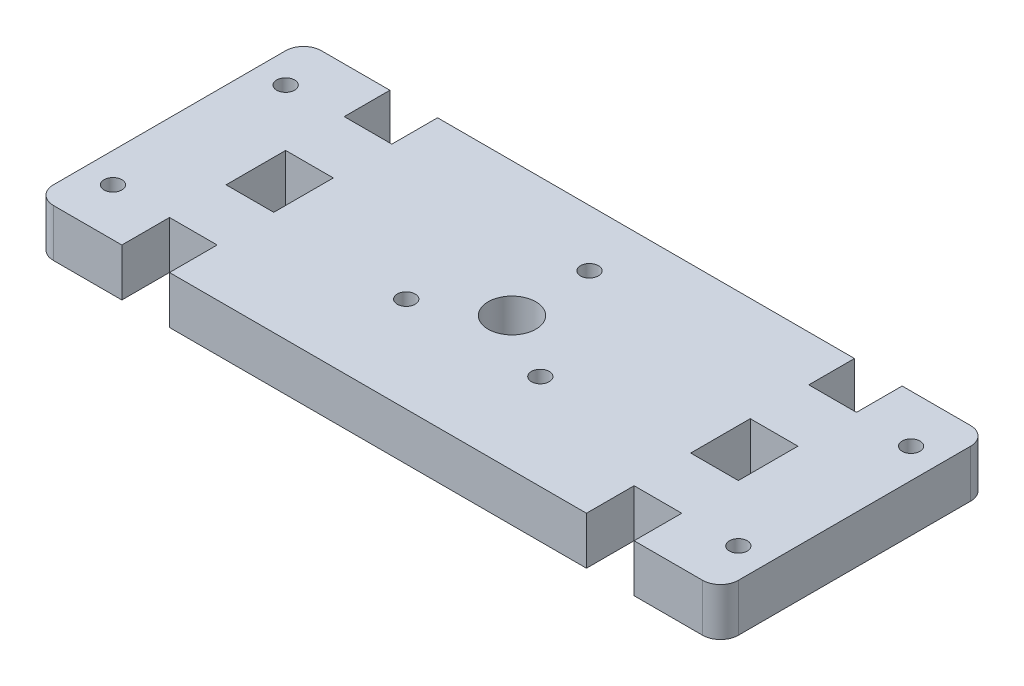
from build123d import *

# Parameters (mm, degrees)
SKETCH1_W           = 115
SKETCH1_H           = 45
SKETCH1_R           = 4
SKETCH1_R_2         = 1.5
BOSS_EXTRUDE1_DEPTH = 8
SKETCH2_W           = 8
SKETCH2_H           = 10
SKETCH2_H_2         = 8
CUT_EXTRUDE1_DEPTH  = 16
FILLET1_R           = 3
SKETCH4_R           = 1.5
CUT_EXTRUDE2_DEPTH  = 16


with BuildPart() as part:
    # Sketch1 → Boss-Extrude1 (new body)
    with BuildSketch(Plane(origin=(0, 0, 0), x_dir=(1, 0, 0), z_dir=(0, 1, 0))):
        Rectangle(SKETCH1_W, SKETCH1_H)
        with Locations(Location((0, 0, 0), (0, 0, 270))):
            Circle(SKETCH1_R, mode=Mode.SUBTRACT)
        with Locations(Location((0, 13, 0), (0, 0, 270))):
            Circle(SKETCH1_R_2, mode=Mode.SUBTRACT)
        with Locations(Location((11.258330249, -6.5, 0), (0, 0, 270))):
            Circle(SKETCH1_R_2, mode=Mode.SUBTRACT)
        with Locations(Location((-11.258330249, -6.5, 0), (0, 0, 270))):
            Circle(SKETCH1_R_2, mode=Mode.SUBTRACT)
    extrude(amount=BOSS_EXTRUDE1_DEPTH)

    # Sketch2 → Cut-Extrude1 (cut)
    with BuildSketch(Plane(origin=(0, 8, 0), x_dir=(1, 0, 0), z_dir=(0, 1, 0))):
        with Locations((-39, 0)):
            Rectangle(SKETCH2_W, SKETCH2_H)
        with Locations((-39, 18.82979477)):
            Rectangle(SKETCH2_W, SKETCH2_H_2)
        with Locations((39, 18.82979477)):
            Rectangle(SKETCH2_W, SKETCH2_H_2)
        with Locations((39, 0)):
            Rectangle(SKETCH2_W, SKETCH2_H)
        with Locations((-39, -18.5)):
            Rectangle(SKETCH2_W, SKETCH2_H_2)
        with Locations((39, -18.5)):
            Rectangle(SKETCH2_W, SKETCH2_H_2)
    extrude(amount=-CUT_EXTRUDE1_DEPTH, mode=Mode.SUBTRACT)

    # Fillet1
    fillet1_edges = [part.edges().sort_by_distance(p)[0] for p in [
        (-57.5, 4, 22.5),
        (-57.5, 4, -22.5),
        (57.5, 4, -22.5),
        (57.5, 4, 22.5),
    ]]
    fillet(fillet1_edges, radius=FILLET1_R)

    # Sketch4 → Cut-Extrude2 (cut)
    with BuildSketch(Plane(origin=(0, 8, 0), x_dir=(1, 0, 0), z_dir=(0, 1, 0))):
        with Locations(Location((52.5, 14.5, 0), (0, 0, 270))):
            Circle(SKETCH4_R)
        with Locations(Location((-52.5, 14.5, 0), (0, 0, 270))):
            Circle(SKETCH4_R)
        with Locations(Location((-52.5, -14.5, 0), (0, 0, 270))):
            Circle(SKETCH4_R)
        with Locations(Location((52.5, -14.5, 0), (0, 0, 270))):
            Circle(SKETCH4_R)
    extrude(amount=-CUT_EXTRUDE2_DEPTH, mode=Mode.SUBTRACT)


solid = part.part
